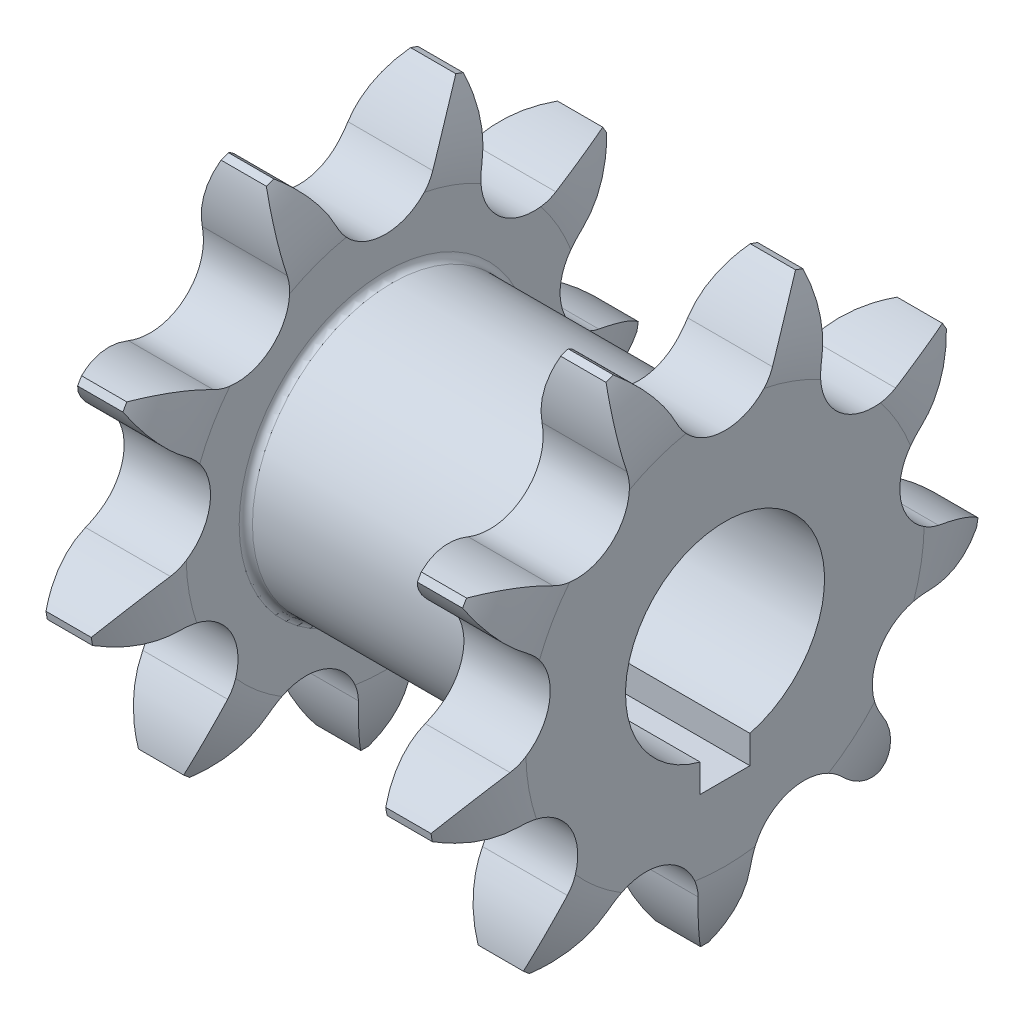
from build123d import *

# Parameters (mm, degrees)
GROOVES_COUNT      = 2
GROOVES_PITCH      = 10.24
TOOTHCUT_DEPTH     = 35.895454976
TEETHCUTS_COUNT    = 9
TEETHCUTS_ANGLE    = 320
BORSKE_R           = 6
BORE_DEPTH         = 50.0005
KEYSKE_W           = 3
KEYSKE_H           = 7.5
KEYWAY_DEPTH       = 50.0005
CUT_EXTRUDE1_START = 3
SKETCH1_OUTSIDE_W  = 45.564
SKETCH1_OUTSIDE_H  = 45.064
SKETCH1_OUTSIDE_R  = 8.409661226
CUT_EXTRUDE1_DEPTH = 10


with BuildPart() as part:
    # BasProSke → Base-Revolve (revolve)
    with BuildSketch(Plane(origin=(0, 0, 0), x_dir=(1, 0, 0), z_dir=(0, 1, 0)), mode=Mode.PRIVATE) as base_revolve_sk:
        with BuildLine():
            Line((0, 0), (0, 12.006866982))
            ThreePointArc((0, 12.006866982), (0.314698702, 14.435029868), (1.238, 16.702743471))
            Line((1.238, 16.702743471), (24.4472, 16.702743471))
            ThreePointArc((24.4472, 16.702743471), (25.370501298, 14.435029868), (25.6852, 12.006866982))
            Line((25.6852, 12.006866982), (25.6852, 0))
            Line((25.6852, 0), (0, 0))
        make_face()
    revolve(base_revolve_sk.sketch.rotate(Axis((-10, 0, 0), (1, 0, 0)), 180), axis=Axis((-10, 0, 0), (1, 0, 0)))

    # GrvSke → Groove (revolve, cut)
    with BuildSketch(Plane(origin=(0, 0, 0), x_dir=(1, 0, 0), z_dir=(0, 1, 0)), mode=Mode.PRIVATE) as groove_sk:
        with BuildLine():
            Line((5.2052, 12.006866982), (5.2052, 8.809661226))
            ThreePointArc((5.2052, 8.809661226), (5.322357288, 8.526818514), (5.6052, 8.409661226))
            Line((5.6052, 8.409661226), (9.84, 8.409661226))
            ThreePointArc((9.84, 8.409661226), (10.122842712, 8.526818514), (10.24, 8.809661226))
            Line((10.24, 8.809661226), (10.24, 12.006866982))
            ThreePointArc((10.24, 12.006866982), (10.554698702, 14.435029868), (11.478, 16.702743471))
            Line((11.478, 16.702743471), (3.9672, 16.702743471))
            ThreePointArc((3.9672, 16.702743471), (4.890501298, 14.435029868), (5.2052, 12.006866982))
        make_face()
    groove = revolve(groove_sk.sketch.rotate(Axis((0, 0, 0), (1, 0, 0)), 180), axis=Axis((0, 0, 0), (1, 0, 0)), mode=Mode.SUBTRACT)

    # Grooves: Groove ×2
    with Locations(*[(i * GROOVES_PITCH, 0, 0) for i in range(1, GROOVES_COUNT)]):
        add(groove, mode=Mode.SUBTRACT)

    # TooCutSke → ToothCut (cut, through all)
    with BuildSketch(Plane(origin=(0, 0, 0), x_dir=(0, 0, -1), z_dir=(1, 0, 0))):
        with BuildLine():
            ThreePointArc((2.906302496, 12.60113736), (4.198990076, 14.583034398), (5.994051414, 16.124693193))
            ThreePointArc((5.994051414, 16.124693193), (0, 17.202743471), (-5.994051414, 16.124693193))
            ThreePointArc((-5.994051414, 16.124693193), (-4.198990076, 14.583034398), (-2.906302496, 12.60113736))
            ThreePointArc((-2.906302496, 12.60113736), (0, 10.749618471), (2.906302496, 12.60113736))
        make_face()
    toothcut = extrude(amount=TOOTHCUT_DEPTH, mode=Mode.SUBTRACT)

    # TeethCuts: ToothCut ×9 about axis
    teethcuts_axis = Axis((-10, 0, 0), (1, 0, 0))
    for i in range(1, TEETHCUTS_COUNT):
        add(toothcut.rotate(teethcuts_axis, i * TEETHCUTS_ANGLE / (TEETHCUTS_COUNT - 1)), mode=Mode.SUBTRACT)

    # BorSke → Bore (cut, symmetric)
    with BuildSketch(Plane(origin=(0, 0, 0), x_dir=(0, 0, -1), z_dir=(1, 0, 0))):
        with Locations(Location((0, 0, 0), (0, 0, 180))):
            Circle(BORSKE_R)
    extrude(amount=BORE_DEPTH, both=True, mode=Mode.SUBTRACT)

    # KeySke → Keyway (cut, symmetric)
    with BuildSketch(Plane(origin=(0, 0, 0), x_dir=(0, 0, -1), z_dir=(1, 0, 0))):
        with Locations((0, -3.75)):
            Rectangle(KEYSKE_W, KEYSKE_H)
    extrude(amount=KEYWAY_DEPTH, both=True, mode=Mode.SUBTRACT)

    # Sketch1 outside → Cut-Extrude1 (cut)
    with BuildSketch(Plane.ZY.offset(-20.48).offset(CUT_EXTRUDE1_START)):
        with Locations((0, -0.464)):
            Rectangle(SKETCH1_OUTSIDE_W, SKETCH1_OUTSIDE_H)
        Circle(SKETCH1_OUTSIDE_R, mode=Mode.SUBTRACT)
    extrude(amount=CUT_EXTRUDE1_DEPTH, mode=Mode.SUBTRACT)


solid = part.part
